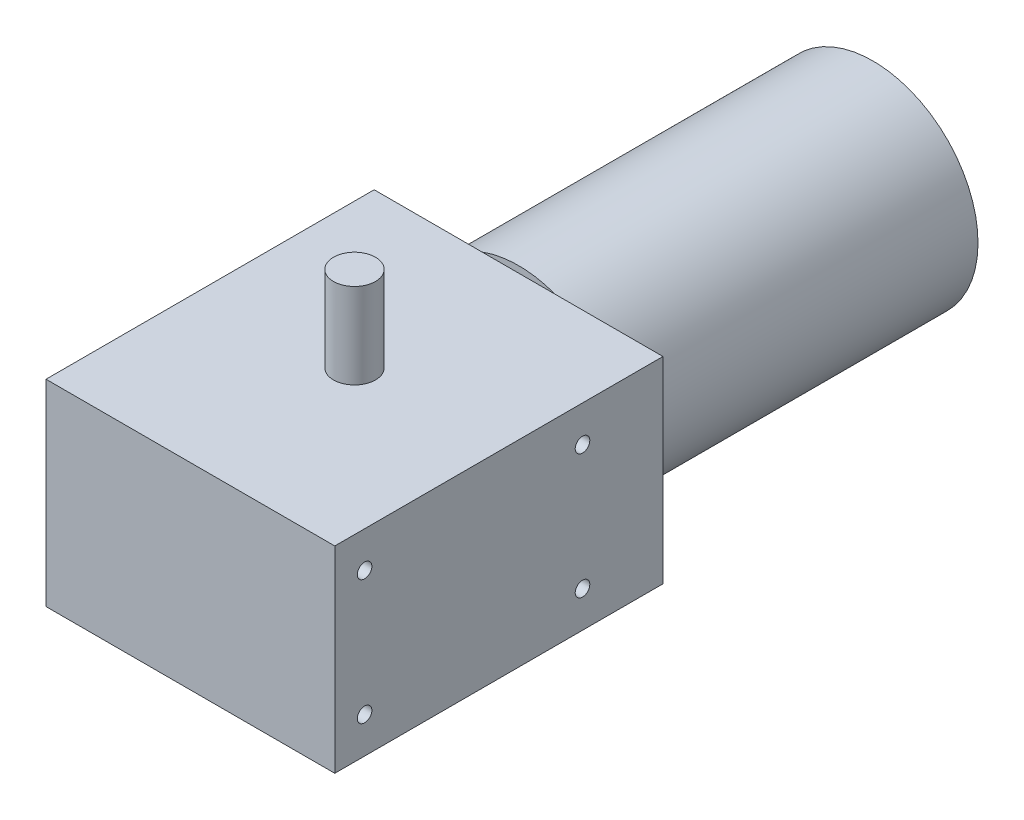
from build123d import *

# Parameters (mm, degrees)
CROQUIS1_W              = 220
CROQUIS1_H              = 150
SALIENTE_EXTRUIR1_DEPTH = 125
CROQUIS2_R              = 16
SALIENTE_EXTRUIR2_DEPTH = 140
CROQUIS3_R              = 5.55625
CORTAR_EXTRUIR1_DEPTH   = 200
CROQUIS4_R              = 80
SALIENTE_EXTRUIR3_DEPTH = 270


with BuildPart() as part:
    # Croquis1 → Saliente-Extruir1 (new, symmetric)
    with BuildSketch(Plane.XY):
        Rectangle(CROQUIS1_W, CROQUIS1_H)
    extrude(amount=SALIENTE_EXTRUIR1_DEPTH, both=True)

    # Croquis2 → Saliente-Extruir2 (add, symmetric)
    with BuildSketch(Plane(origin=(0, 0, 0), x_dir=(1, 0, 0), z_dir=(0, 1, 0))):
        with Locations(Location((0, 0, 0), (0, 0, 270))):
            Circle(CROQUIS2_R)
    extrude(amount=SALIENTE_EXTRUIR2_DEPTH, both=True)

    # Croquis3 → Cortar-Extruir1 (cut)
    with BuildSketch(Plane(origin=(110, 0, 0), x_dir=(0, 0, -1), z_dir=(1, 0, 0))):
        with Locations((-102.3, 47.5)):
            Circle(CROQUIS3_R)
        with Locations((-102.3, -47.5)):
            Circle(CROQUIS3_R)
        with Locations((63.7, 47.5)):
            Circle(CROQUIS3_R)
        with Locations((63.7, -47.5)):
            Circle(CROQUIS3_R)
    extrude(amount=-CORTAR_EXTRUIR1_DEPTH, mode=Mode.SUBTRACT)

    # Croquis4 → Saliente-Extruir3 (add)
    with BuildSketch(Plane(origin=(0, 0, -125), x_dir=(-1, 0, 0), z_dir=(0, 0, -1))):
        with Locations(Location((0, 0, 0), (0, 0, 110.364134806))):
            Circle(CROQUIS4_R)
    extrude(amount=SALIENTE_EXTRUIR3_DEPTH)


solid = part.part
